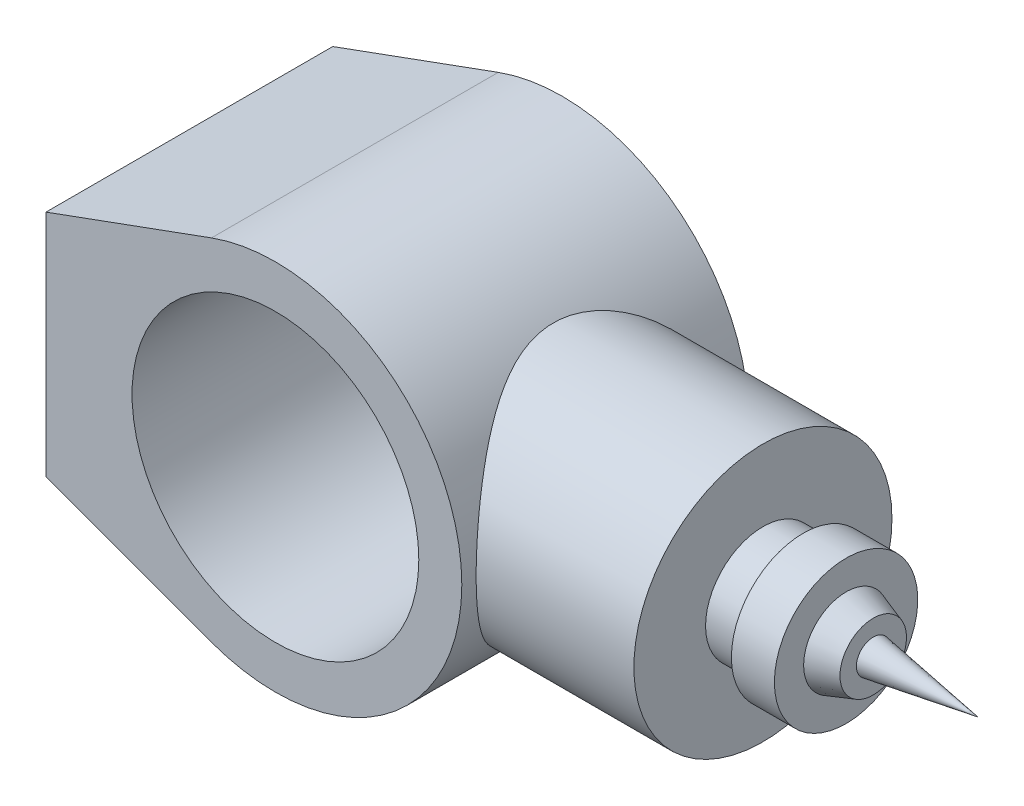
from build123d import *

# Parameters (mm, degrees)
SKETCH1_R                = 50
BOSS_EXTRUDE1_DEPTH      = 50
BOSS_EXTRUDE2_REACH      = 218.16
BOSS_EXTRUDE2_END_RADIUS = 65
SKETCH2_R                = 45


with BuildPart() as part:
    # Sketch1 → Boss-Extrude1 (new, symmetric)
    with BuildSketch(Plane.XY):
        with BuildLine():
            Line((-80, 40), (-80, -40))
            Line((-80, -40), (-22.281665693, -61.061668614))
            ThreePointArc((-22.281665693, -61.061668614), (65, 0), (-22.281665693, 61.061668614))
            Line((-22.281665693, 61.061668614), (-80, 40))
        make_face()
        Circle(SKETCH1_R, mode=Mode.SUBTRACT)
    extrude(amount=BOSS_EXTRUDE1_DEPTH, both=True)

    # Boss-Extrude2: up to this cylinder (the profile starts outside it)
    boss_extrude2_end = Plane(origin=(0, 0, 0), z_dir=(0, 0, -1)) * Cylinder(BOSS_EXTRUDE2_END_RADIUS, 567.32, mode=Mode.PRIVATE)
    # Sketch2 → Boss-Extrude2 (add, up to the surface)
    with BuildSketch(Plane(origin=(120, 0, 0), x_dir=(0, 0, -1), z_dir=(1, 0, 0)), mode=Mode.PRIVATE) as boss_extrude2_sk1:
        Circle(SKETCH2_R)
    boss_extrude2_tool1 = extrude(boss_extrude2_sk1.sketch, amount=-BOSS_EXTRUDE2_REACH, mode=Mode.PRIVATE) - boss_extrude2_end
    add(boss_extrude2_tool1.solids().sort_by_distance((120, 0, 0))[0])

    # Sketch3 → Revolve1 (revolve)
    with BuildSketch(Plane.XY, mode=Mode.PRIVATE) as revolve1_sk:
        Polygon((120, -20), (134, -20), (134, -25), (149, -25), (149, -14.806160135), (158.470531587, -11.595392086), (158.470531587, -5.882001144), (195, 0), (120, 0), align=None)
    revolve(revolve1_sk.sketch.rotate(Axis((0, 0, 0), (1, 0, 0)), 270), axis=Axis((0, 0, 0), (1, 0, 0)))


solid = part.part
